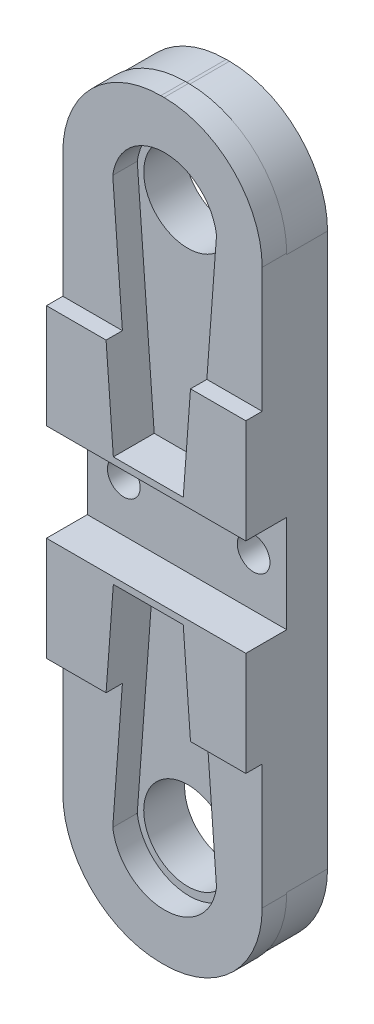
from build123d import *

# Parameters (mm, degrees)
SKETCH1_W           = 12.2
SKETCH1_H           = 45.8
BOSS_EXTRUDE1_DEPTH = 2.5
FILLET1_R           = 6
SKETCH2_W           = 12.2
SKETCH2_H           = 20
BOSS_EXTRUDE2_DEPTH = 2.5
FILLET2_R           = 6
SKETCH3_R           = 1
CUT_EXTRUDE1_DEPTH  = 2.5
CUT_EXTRUDE2_DEPTH  = 2.5
SKETCH5_R           = 2.7
CUT_EXTRUDE3_DEPTH  = 2.5
SKETCH6_W           = 13.581434372
SKETCH6_H           = 14.584829414
CUT_EXTRUDE4_DEPTH  = 1


with BuildPart() as part:
    # Sketch1 → Boss-Extrude1 (new body)
    with BuildSketch(Plane.XY.offset(10)):
        with Locations((-182.131179691, 159.988166791)):
            Rectangle(SKETCH1_W, SKETCH1_H)
    extrude(amount=BOSS_EXTRUDE1_DEPTH)

    # Fillet1
    fillet1_edges = [part.edges().sort_by_distance(p)[0] for p in [
        (-188.231179691, 182.888166791, 11.25),
        (-176.031179691, 182.888166791, 11.25),
        (-176.031179691, 137.088166791, 11.25),
        (-188.231179691, 137.088166791, 11.25),
    ]]
    fillet(fillet1_edges, radius=FILLET1_R)

    # Sketch2 → Boss-Extrude2 (add)
    with BuildSketch(Plane.XY.offset(12.5)):
        with Locations((-182.131179691, 172.965455297)):
            Rectangle(SKETCH2_W, SKETCH2_H)
        with Locations((-182.131179691, 147.010878284)):
            Rectangle(SKETCH2_W, SKETCH2_H)
    extrude(amount=BOSS_EXTRUDE2_DEPTH)

    # Fillet2
    fillet2_edges = [part.edges().sort_by_distance(p)[0] for p in [
        (-176.031179691, 182.965455297, 13.75),
        (-188.231179691, 182.965455297, 13.75),
        (-176.031179691, 137.010878284, 13.75),
        (-188.231179691, 137.010878284, 13.75),
    ]]
    fillet(fillet2_edges, radius=FILLET2_R)

    # Sketch3 → Cut-Extrude1 (cut)
    with BuildSketch(Plane.XY.offset(12.5)):
        with Locations((-185.999682024, 160.057912714)):
            Circle(SKETCH3_R)
        with Locations((-178.054871456, 160.057912714)):
            Circle(SKETCH3_R)
    extrude(amount=-CUT_EXTRUDE1_DEPTH, mode=Mode.SUBTRACT)

    # Sketch4 → Cut-Extrude2 (cut)
    with BuildSketch(Plane.XY.offset(15)):
        with BuildLine():
            Line((-184.138427734, 163.365707397), (-179.861572266, 163.365707397))
            Line((-179.861572266, 163.365707397), (-178.824890137, 177.264755249))
            ThreePointArc((-178.824890137, 177.264755249), (-182, 180.059517658), (-185.175109863, 177.264755249))
            Line((-185.175109863, 177.264755249), (-184.138427734, 163.365707397))
        make_face()
        with BuildLine():
            Line((-184.138427734, 156.610626184), (-185.175109863, 142.711578332))
            ThreePointArc((-185.175109863, 142.711578332), (-182, 139.916815923), (-178.824890137, 142.711578332))
            Line((-178.824890137, 142.711578332), (-179.861572266, 156.610626184))
            Line((-179.861572266, 156.610626184), (-184.138427734, 156.610626184))
        make_face()
    extrude(amount=-CUT_EXTRUDE2_DEPTH, mode=Mode.SUBTRACT)

    # Sketch5 → Cut-Extrude3 (cut)
    with BuildSketch(Plane.XY.offset(12.5)):
        with Locations((-182.080577922, 176.90016829)):
            Circle(SKETCH5_R)
        with Locations(Location((-182.080577922, 143.076165291, 0), (0, 0, 180))):
            Circle(SKETCH5_R)
    extrude(amount=-CUT_EXTRUDE3_DEPTH, mode=Mode.SUBTRACT)

    # Sketch6 → Cut-Extrude4 (cut)
    with BuildSketch(Plane.XY.offset(15)):
        with Locations((-182.821896877, 176.627084813)):
            Rectangle(SKETCH6_W, SKETCH6_H)
        with Locations((-182.821896877, 143.349248768)):
            Rectangle(SKETCH6_W, SKETCH6_H)
    extrude(amount=-CUT_EXTRUDE4_DEPTH, mode=Mode.SUBTRACT)


solid = part.part
